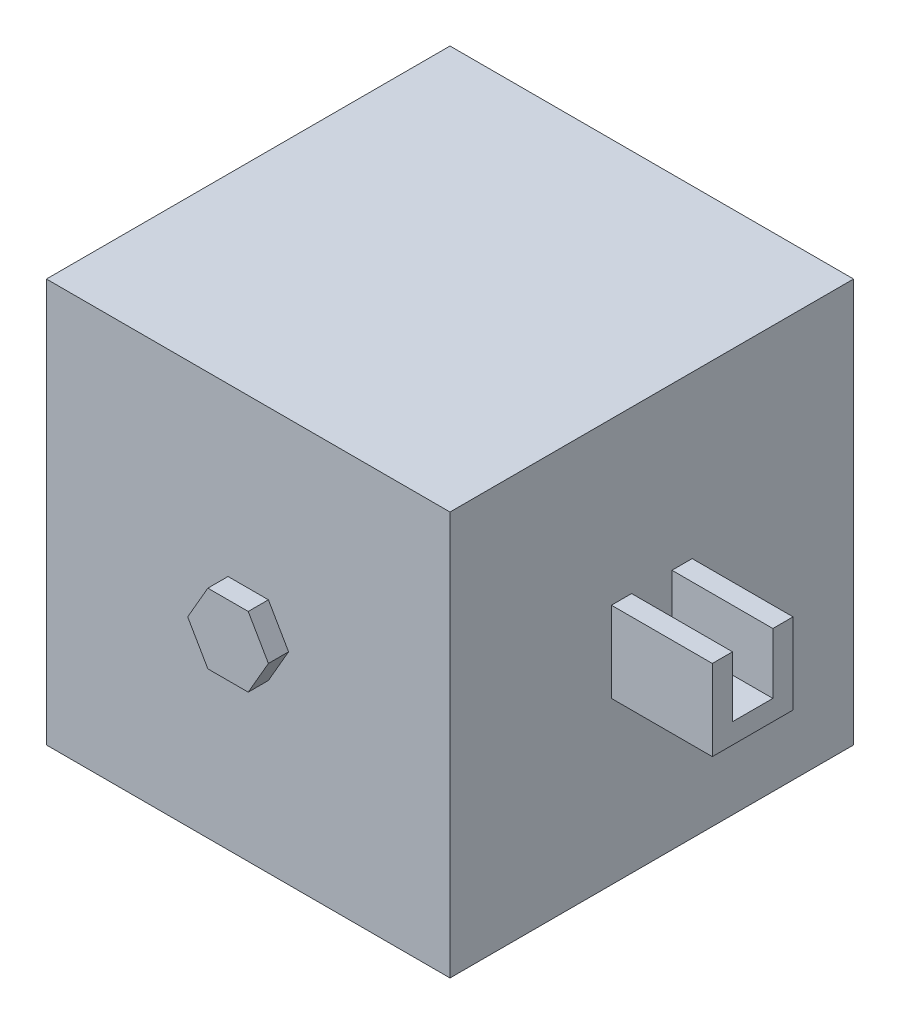
from build123d import *

# Parameters (mm, degrees)
SKETCH1_W           = 50
SKETCH1_H           = 50
BOSS_EXTRUDE1_DEPTH = 50
SKETCH2_W           = 5
SKETCH2_H           = 5
BOSS_EXTRUDE2_DEPTH = 12.5
SKETCH3_W           = 5
SKETCH3_H           = 7.5
CUT_EXTRUDE1_DEPTH  = 12.5
SKETCH6_W           = 10
SKETCH6_H           = 10
BOSS_EXTRUDE3_DEPTH = 12.5
SKETCH7_W           = 5
SKETCH7_H           = 7.5
CUT_EXTRUDE2_DEPTH  = 12.5
BOSS_EXTRUDE5_DEPTH = 2.5
BOSS_EXTRUDE6_DEPTH = 2.5


with BuildPart() as part:
    # Sketch1 → Boss-Extrude1 (new body)
    with BuildSketch(Plane.XY):
        Rectangle(SKETCH1_W, SKETCH1_H)
    extrude(amount=BOSS_EXTRUDE1_DEPTH)

    # Sketch2 → Boss-Extrude2 (add)
    with BuildSketch(Plane.ZY.offset(25)):
        with Locations((27.5, -2.5)):
            Rectangle(SKETCH2_W, SKETCH2_H)
        with Locations((22.5, -2.5)):
            Rectangle(SKETCH2_W, SKETCH2_H)
        with Locations((22.5, 2.5)):
            Rectangle(SKETCH2_W, SKETCH2_H)
        with Locations((27.5, 2.5)):
            Rectangle(SKETCH2_W, SKETCH2_H)
    extrude(amount=BOSS_EXTRUDE2_DEPTH)

    # Sketch3 → Cut-Extrude1 (cut)
    with BuildSketch(Plane.ZY.offset(37.5)):
        with Locations((25, 1.25)):
            Rectangle(SKETCH3_W, SKETCH3_H)
    extrude(amount=-CUT_EXTRUDE1_DEPTH, mode=Mode.SUBTRACT)

    # Sketch6 → Boss-Extrude3 (add)
    with BuildSketch(Plane(origin=(25, 0, 0), x_dir=(0, 0, -1), z_dir=(1, 0, 0))):
        with Locations((-25, 0)):
            Rectangle(SKETCH6_W, SKETCH6_H)
    extrude(amount=BOSS_EXTRUDE3_DEPTH)

    # Sketch7 → Cut-Extrude2 (cut)
    with BuildSketch(Plane(origin=(37.5, 0, 0), x_dir=(0, 0, -1), z_dir=(1, 0, 0))):
        with Locations((-25, 1.25)):
            Rectangle(SKETCH7_W, SKETCH7_H)
    extrude(amount=-CUT_EXTRUDE2_DEPTH, mode=Mode.SUBTRACT)

    # Sketch16 → Boss-Extrude5 (add)
    with BuildSketch(Plane.XY.offset(50)):
        Polygon((5, 0), (2.5, 4.330127019), (-2.5, 4.330127019), (-5, 0), (-2.5, -4.330127019), (2.5, -4.330127019), align=None)
    extrude(amount=BOSS_EXTRUDE5_DEPTH)

    # Sketch17 → Boss-Extrude6 (add)
    with BuildSketch(Plane(origin=(0, 0, 0), x_dir=(-1, 0, 0), z_dir=(0, 0, -1))):
        Polygon((5, 0), (2.5, 4.330127019), (-2.5, 4.330127019), (-5, 0), (-2.5, -4.330127019), (2.5, -4.330127019), align=None)
    extrude(amount=BOSS_EXTRUDE6_DEPTH)


solid = part.part
